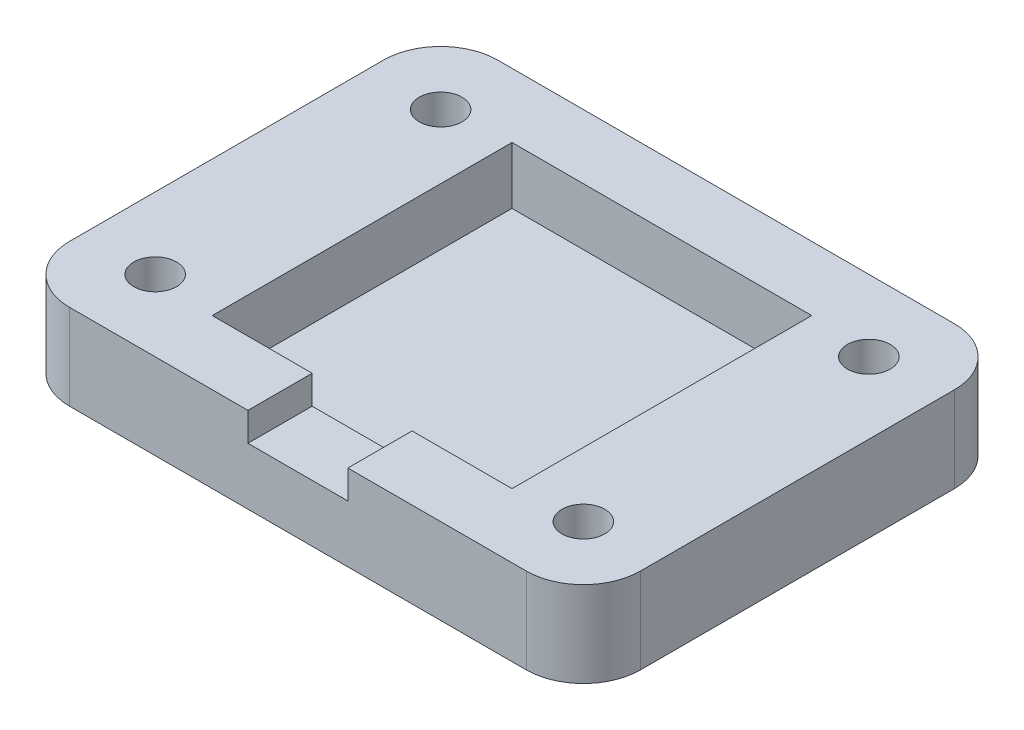
from build123d import *

# Parameters (mm, degrees)
SKETCH1_W           = 40
SKETCH1_H           = 30
BOSS_EXTRUDE1_DEPTH = 6
SKETCH2_R           = 1.5
CUT_EXTRUDE1_DEPTH  = 6
FILLET1_R           = 4
SKETCH3_W           = 21
SKETCH3_H           = 21
CUT_EXTRUDE2_DEPTH  = 4
SKETCH4_W           = 7
SKETCH4_H           = 4.5
CUT_EXTRUDE3_DEPTH  = 2


with BuildPart() as part:
    # Sketch1 → Boss-Extrude1 (new body)
    with BuildSketch(Plane(origin=(0, 0, 0), x_dir=(1, 0, 0), z_dir=(0, 1, 0))):
        with Locations((20, 15)):
            Rectangle(SKETCH1_W, SKETCH1_H)
    extrude(amount=BOSS_EXTRUDE1_DEPTH)

    # Sketch2 → Cut-Extrude1 (cut)
    with BuildSketch(Plane(origin=(0, 6, 0), x_dir=(1, 0, 0), z_dir=(0, 1, 0))):
        with Locations(Location((5, 5, 0), (0, 0, 270))):
            Circle(SKETCH2_R)
        with Locations(Location((5, 25, 0), (0, 0, 90))):
            Circle(SKETCH2_R)
        with Locations(Location((35, 5, 0), (0, 0, 90))):
            Circle(SKETCH2_R)
        with Locations(Location((35, 25, 0), (0, 0, 270))):
            Circle(SKETCH2_R)
    extrude(amount=-CUT_EXTRUDE1_DEPTH, mode=Mode.SUBTRACT)

    # Fillet1
    fillet1_edges = [part.edges().sort_by_distance(p)[0] for p in [
        (0, 3, -30),
        (40, 3, -30),
        (40, 3, 0),
        (0, 3, 0),
    ]]
    fillet(fillet1_edges, radius=FILLET1_R)

    # Sketch3 → Cut-Extrude2 (cut)
    with BuildSketch(Plane(origin=(0, 6, 0), x_dir=(1, 0, 0), z_dir=(0, 1, 0))):
        with Locations((20, 15)):
            Rectangle(SKETCH3_W, SKETCH3_H)
    extrude(amount=-CUT_EXTRUDE2_DEPTH, mode=Mode.SUBTRACT)

    # Sketch4 → Cut-Extrude3 (cut)
    with BuildSketch(Plane(origin=(0, 6, 0), x_dir=(1, 0, 0), z_dir=(0, 1, 0))):
        with Locations((20, 2.25)):
            Rectangle(SKETCH4_W, SKETCH4_H)
    extrude(amount=-CUT_EXTRUDE3_DEPTH, mode=Mode.SUBTRACT)


solid = part.part
